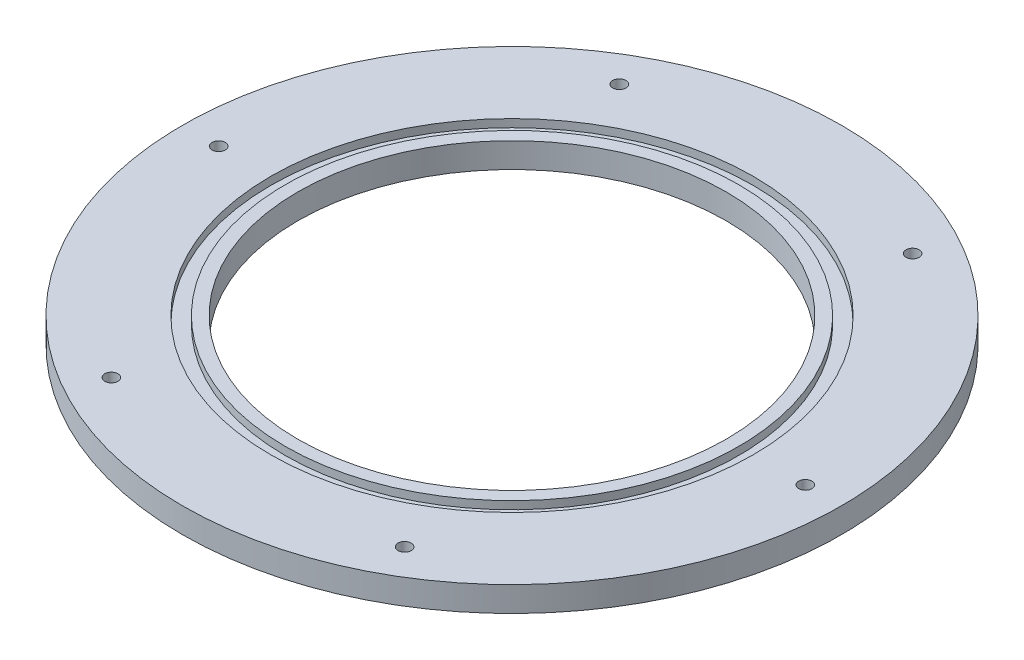
from build123d import *

# Parameters (mm, degrees)
SKETCH1_R           = 250
SKETCH1_R_2         = 162.5
BOSS_EXTRUDE1_DEPTH = 9.5
SKETCH2_R           = 5
CUT_EXTRUDE1_DEPTH  = 355.063553617
SKETCH3_R           = 183
SKETCH3_R_2         = 172
CUT_EXTRUDE2_DEPTH  = 6


with BuildPart() as part:
    # Sketch1 → Boss-Extrude1 (new, symmetric)
    with BuildSketch(Plane(origin=(0, 0, 0), x_dir=(1, 0, 0), z_dir=(0, 1, 0))):
        with Locations(Location((0, 0, 0), (0, 0, 270))):
            Circle(SKETCH1_R)
        with Locations(Location((0, 0, 0), (0, 0, 270))):
            Circle(SKETCH1_R_2, mode=Mode.SUBTRACT)
    extrude(amount=BOSS_EXTRUDE1_DEPTH, both=True)

    # Sketch2 → Cut-Extrude1 (cut, through all)
    with BuildSketch(Plane(origin=(0, 9.5, 0), x_dir=(1, 0, 0), z_dir=(0, 1, 0))):
        with Locations(Location((111.25, 192.690652342, 0), (0, 0, 270))):
            Circle(SKETCH2_R)
        with Locations(Location((222.5, 0, 0), (0, 0, 270))):
            Circle(SKETCH2_R)
        with Locations(Location((-222.5, 0, 0), (0, 0, 90))):
            Circle(SKETCH2_R)
        with Locations(Location((-111.25, 192.690652342, 0), (0, 0, 90))):
            Circle(SKETCH2_R)
        with Locations(Location((111.25, -192.690652342, 0), (0, 0, 90))):
            Circle(SKETCH2_R)
        with Locations(Location((-111.25, -192.690652342, 0), (0, 0, 270))):
            Circle(SKETCH2_R)
    extrude(amount=-CUT_EXTRUDE1_DEPTH, mode=Mode.SUBTRACT)

    # Sketch3 → Cut-Extrude2 (cut)
    with BuildSketch(Plane(origin=(0, 9.5, 0), x_dir=(1, 0, 0), z_dir=(0, 1, 0))):
        with Locations(Location((0, 0, 0), (0, 0, 270))):
            Circle(SKETCH3_R)
        with Locations(Location((0, 0, 0), (0, 0, 270))):
            Circle(SKETCH3_R_2, mode=Mode.SUBTRACT)
    extrude(amount=-CUT_EXTRUDE2_DEPTH, mode=Mode.SUBTRACT)


solid = part.part
